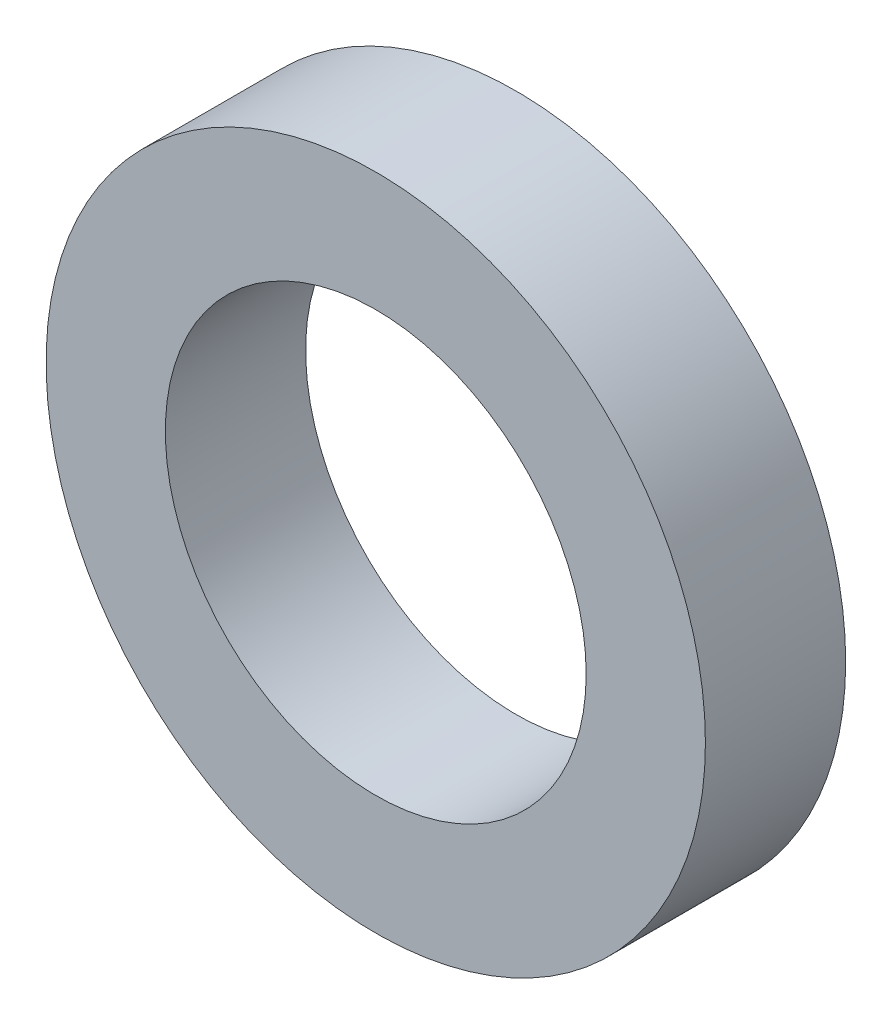
from build123d import *

# Parameters (mm, degrees)
SCHIZZO1_R                   = 2.35
SCHIZZO1_R_2                 = 1.5
ESTRUSIONE_ESTRUSIONE1_DEPTH = 1


with BuildPart() as part:
    # Schizzo1 → Estrusione-Estrusione1 (new body)
    with BuildSketch(Plane.XY):
        Circle(SCHIZZO1_R)
        Circle(SCHIZZO1_R_2, mode=Mode.SUBTRACT)
    extrude(amount=ESTRUSIONE_ESTRUSIONE1_DEPTH)


solid = part.part
